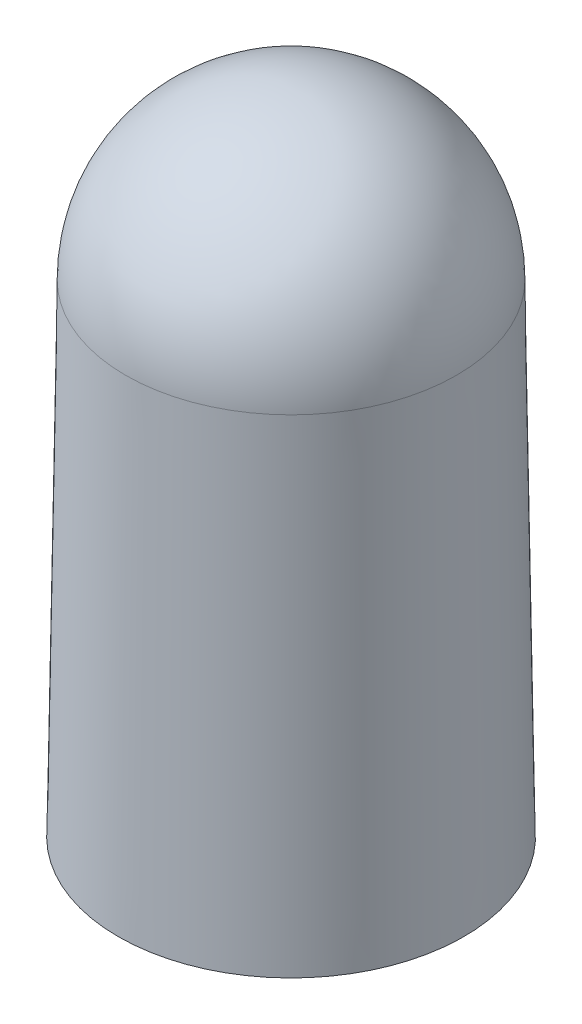
from build123d import *


with BuildPart() as part:
    # Sketch2 → Revolve1 (revolve)
    with BuildSketch(Plane.XY):
        with BuildLine():
            Line((12, 0), (12.537470138, -35))
            Line((12.537470138, -35), (10.5, -35))
            Line((10.5, -35), (10.5, 0))
            ThreePointArc((10.5, 0), (7.424621202, 7.424621202), (0, 10.5))
            Line((0, 10.5), (0, 12))
            ThreePointArc((0, 12), (8.485281374, 8.485281374), (12, 0))
        make_face()
    revolve(axis=Axis((0, 12, 0), (0, -1, 0)))


solid = part.part
